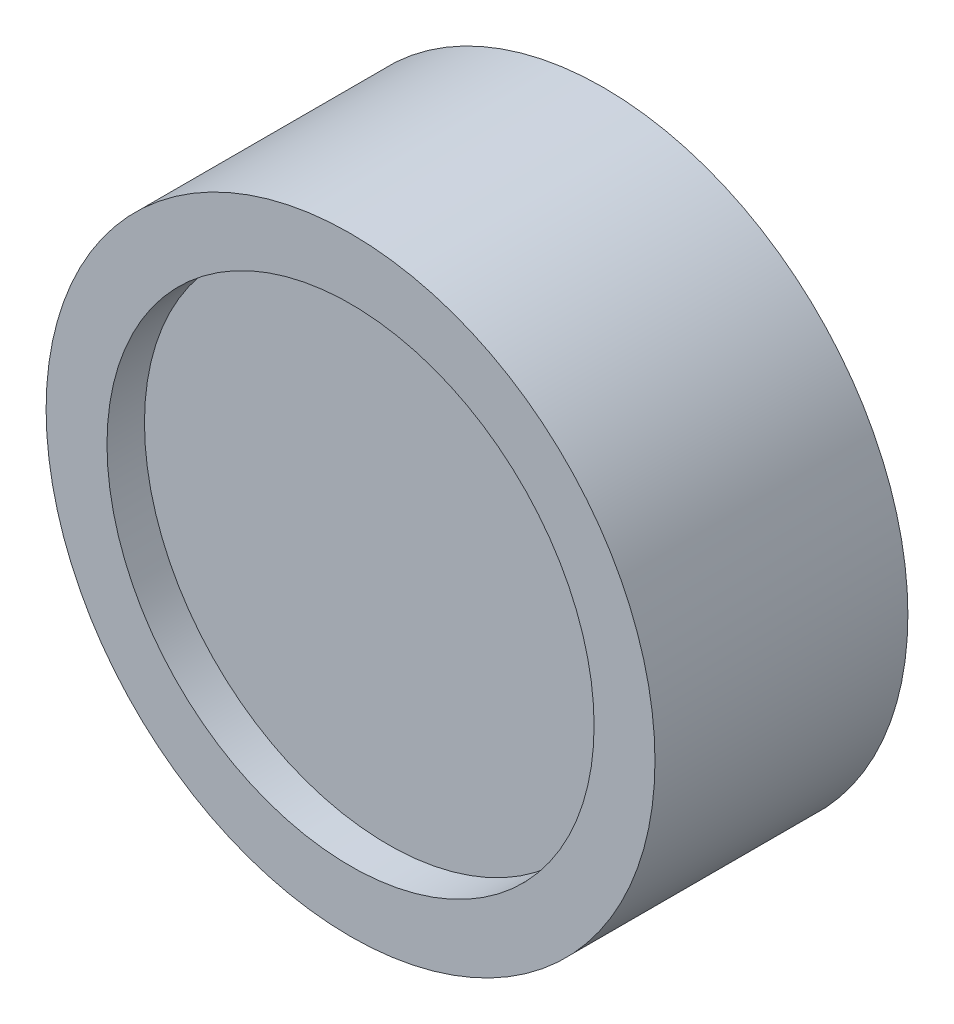
from build123d import *

# Parameters (mm, degrees)
EXTRUDE_1_DEPTH          = 20
EXTRUDE_1_DEPTH_BACK     = 7
SKETCH_1_R               = 32.5
CUT_EXTRUDE_6_DEPTH      = 55
CUT_EXTRUDE_6_DEPTH_BACK = 81
SKETCH_2_R               = 26
EXTRUDE_4_DEPTH          = 16
EXTRUDE_4_DEPTH_BACK     = 3
SKETCH_3_R               = 26


with BuildPart() as part:
    # 草图1 → 凸台-拉伸1 (new, two sides: drawn at the far end of the back side and taken through both)
    with BuildSketch(Plane.XY.offset(-EXTRUDE_1_DEPTH_BACK)):
        Circle(SKETCH_1_R)
    extrude(amount=EXTRUDE_1_DEPTH + EXTRUDE_1_DEPTH_BACK)

    # 草图2 → 切除-拉伸6 (cut, two sides: drawn at the far end of the back side and taken through both)
    with BuildSketch(Plane.XY.offset(-CUT_EXTRUDE_6_DEPTH_BACK)):
        Circle(SKETCH_2_R)
    extrude(amount=CUT_EXTRUDE_6_DEPTH + CUT_EXTRUDE_6_DEPTH_BACK, mode=Mode.SUBTRACT)

    # 草图3 → 凸台-拉伸4 (add, two sides: drawn at the far end of the back side and taken through both)
    with BuildSketch(Plane.XY.offset(-EXTRUDE_4_DEPTH_BACK)):
        Circle(SKETCH_3_R)
    extrude(amount=EXTRUDE_4_DEPTH + EXTRUDE_4_DEPTH_BACK)


solid = part.part
